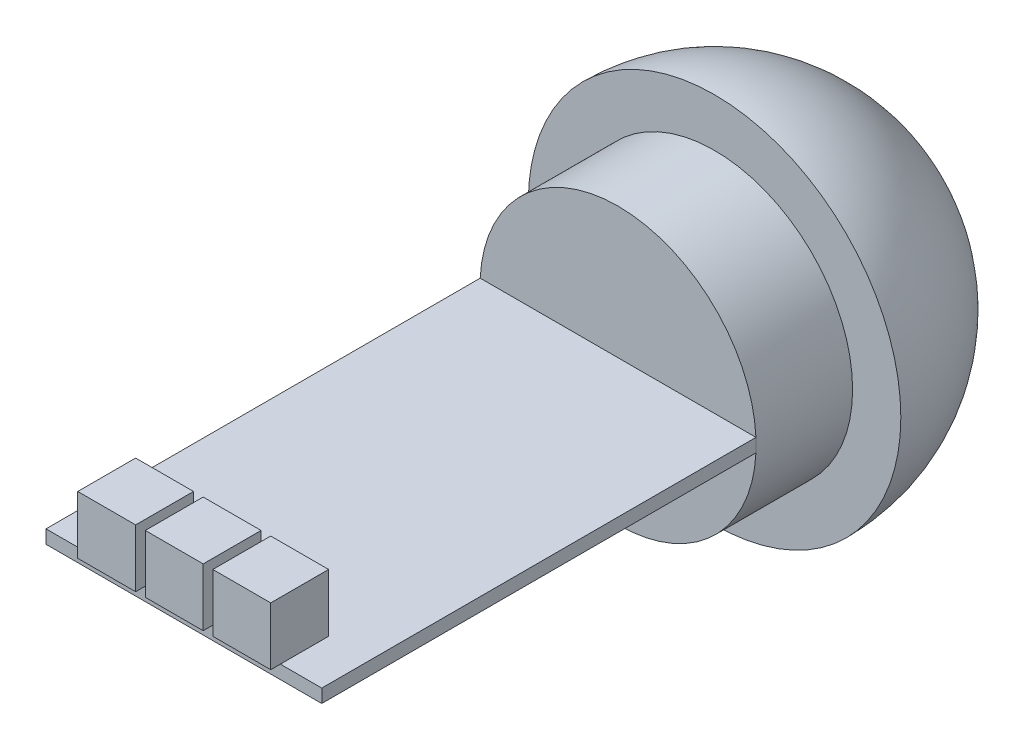
from build123d import *

# Parameters (mm, degrees)
SKETCH2_R           = 14.306408623
BOSS_EXTRUDE1_DEPTH = 10
SKETCH3_W           = 28.579032966
SKETCH3_H           = 1.390030786
BOSS_EXTRUDE2_DEPTH = 45
SKETCH4_W           = 6
SKETCH4_H           = 6
BOSS_EXTRUDE3_DEPTH = 6


with BuildPart() as part:
    # Sketch1 → Revolve1 (revolve)
    with BuildSketch(Plane(origin=(0, 0, 0), x_dir=(1, 0, 0), z_dir=(0, 1, 0))):
        with BuildLine():
            Line((19.306408623, 0), (0, 0))
            Line((0, 0), (0, 19.306408623))
            ThreePointArc((0, 19.306408623), (13.651692458, 13.651692458), (19.306408623, 0))
        make_face()
    revolve(axis=Axis((0, 0, 0), (0, 0, -1)))

    # Sketch2 → Boss-Extrude1 (add)
    with BuildSketch(Plane.XY):
        Circle(SKETCH2_R)
    extrude(amount=BOSS_EXTRUDE1_DEPTH)

    # Sketch3 → Boss-Extrude2 (add)
    with BuildSketch(Plane.XY.offset(10)):
        Rectangle(SKETCH3_W, SKETCH3_H)
    extrude(amount=BOSS_EXTRUDE2_DEPTH)

    # Sketch4 → Boss-Extrude3 (add)
    with BuildSketch(Plane(origin=(0, 0.695015393, 0), x_dir=(1, 0, 0), z_dir=(0, 1, 0))):
        with Locations((7, -53)):
            Rectangle(SKETCH4_W, SKETCH4_H)
        with Locations((0, -53)):
            Rectangle(SKETCH4_W, SKETCH4_H)
        with Locations((-7, -53)):
            Rectangle(SKETCH4_W, SKETCH4_H)
    extrude(amount=BOSS_EXTRUDE3_DEPTH)


solid = part.part
